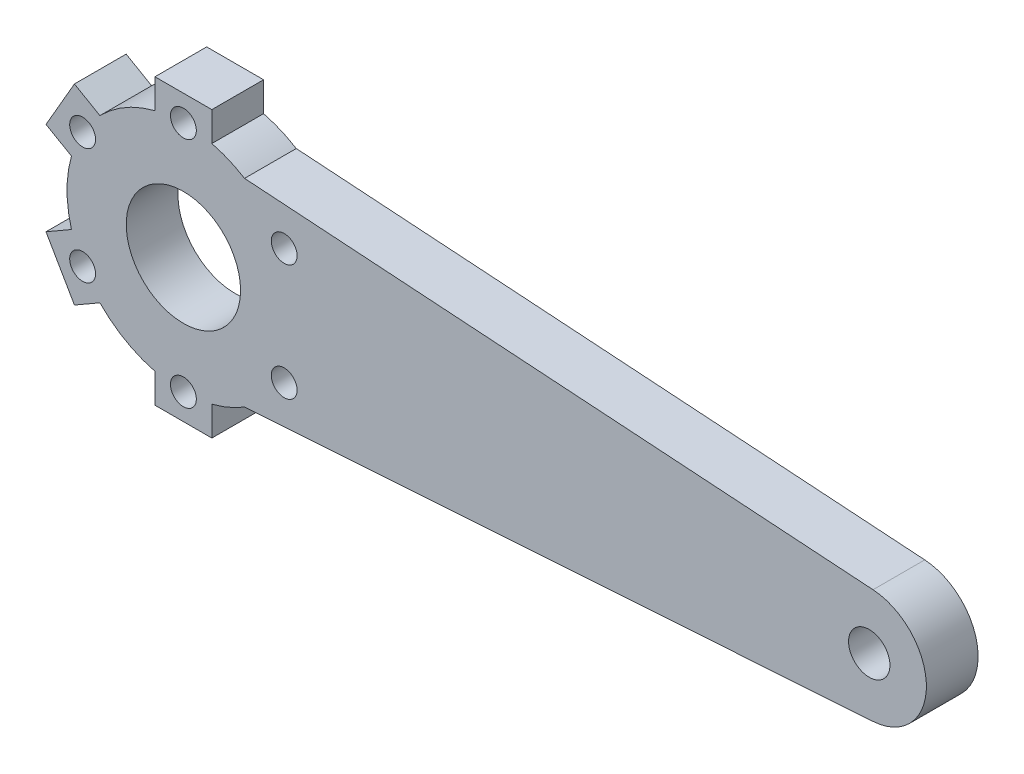
from build123d import *

# Parameters (mm, degrees)
SKETCH_1_R      = 2.5
SKETCH_1_R_2    = 11.05
SKETCH_1_R_3    = 4
EXTRUDE_1_DEPTH = 10


with BuildPart() as part:
    # 草图1 → 凸台-拉伸1 (new body)
    with BuildSketch(Plane.XY):
        with BuildLine():
            ThreePointArc((11.821054836, 19.144520432), (8.76303822, 20.723396468), (5.5, 21.817424229))
            Line((5.5, 21.817424229), (5.5, 27.5))
            Line((5.5, 27.5), (-5.5, 27.5))
            Line((-5.5, 27.5), (-5.5, 21.817424229))
            ThreePointArc((-5.5, 21.817424229), (-11.25, 19.485571585), (-16.144443628, 15.671851835))
            Line((-16.144443628, 15.671851835), (-21.065698604, 18.513139721))
            Line((-21.065698604, 18.513139721), (-26.565698604, 8.986860279))
            Line((-26.565698604, 8.986860279), (-21.644443628, 6.145572394))
            ThreePointArc((-21.644443628, 6.145572394), (-22.5, 0), (-21.644443628, -6.145572394))
            Line((-21.644443628, -6.145572394), (-26.565698604, -8.986860279))
            Line((-26.565698604, -8.986860279), (-21.065698604, -18.513139721))
            Line((-21.065698604, -18.513139721), (-16.144443628, -15.671851835))
            ThreePointArc((-16.144443628, -15.671851835), (-11.25, -19.485571585), (-5.5, -21.817424229))
            Line((-5.5, -21.817424229), (-5.5, -27.5))
            Line((-5.5, -27.5), (5.5, -27.5))
            Line((5.5, -27.5), (5.5, -21.817424229))
            ThreePointArc((5.5, -21.817424229), (8.76303822, -20.723396468), (11.821054836, -19.144520432))
            Line((11.821054836, -19.144520432), (133.336666591, -11.0254171))
            ThreePointArc((133.336666591, -11.0254171), (143.649999924, 0), (133.336666591, 11.0254171))
            Line((133.336666591, 11.0254171), (11.821054836, 19.144520432))
        make_face()
        with Locations((19.485571585, -11.25)):
            Circle(SKETCH_1_R, mode=Mode.SUBTRACT)
        with Locations((19.485571585, 11.25)):
            Circle(SKETCH_1_R, mode=Mode.SUBTRACT)
        with Locations((-19.485571585, -11.25)):
            Circle(SKETCH_1_R, mode=Mode.SUBTRACT)
        with Locations((-19.485571585, 11.25)):
            Circle(SKETCH_1_R, mode=Mode.SUBTRACT)
        with Locations((0, -22.5)):
            Circle(SKETCH_1_R, mode=Mode.SUBTRACT)
        with Locations((0, 22.5)):
            Circle(SKETCH_1_R, mode=Mode.SUBTRACT)
        Circle(SKETCH_1_R_2, mode=Mode.SUBTRACT)
        with Locations((132.599999924, 0)):
            Circle(SKETCH_1_R_3, mode=Mode.SUBTRACT)
    extrude(amount=EXTRUDE_1_DEPTH)


solid = part.part
